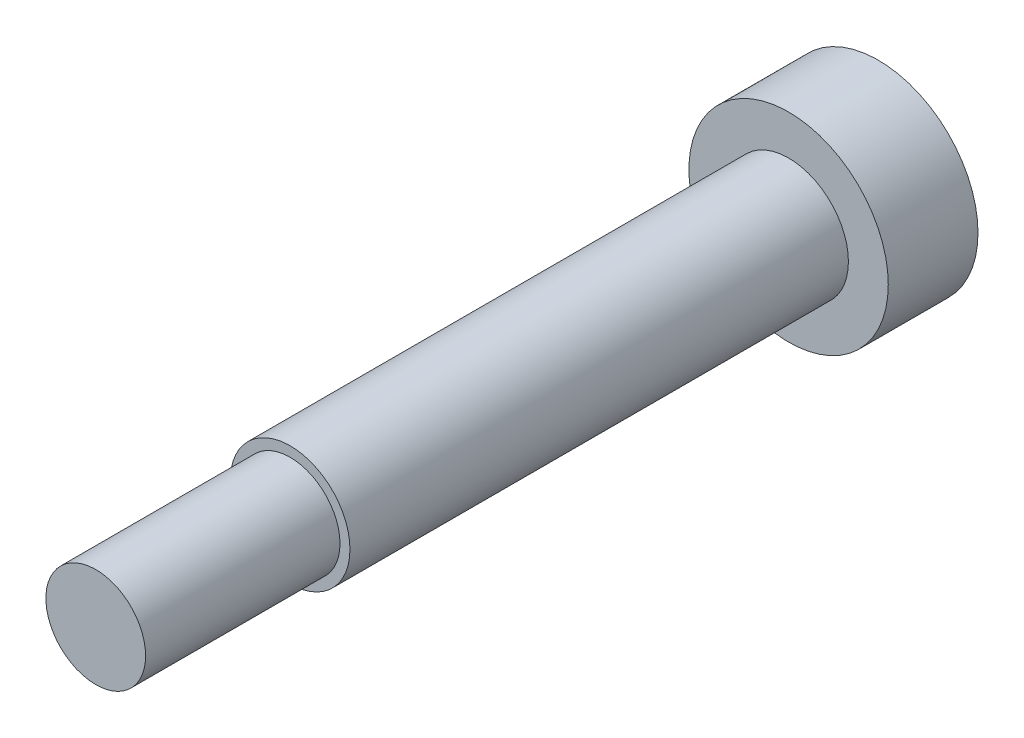
from build123d import *

# Parameters (mm, degrees)
SKETCH_1_R      = 5
EXTRUDE_1_DEPTH = 4.5
SKETCH_2_R      = 3
EXTRUDE_2_DEPTH = 25
SKETCH_3_R      = 2.5
EXTRUDE_3_DEPTH = 9.75


with BuildPart() as part:
    # 草图1 → 凸台-拉伸1 (new body)
    with BuildSketch(Plane.XY):
        Circle(SKETCH_1_R)
    extrude(amount=EXTRUDE_1_DEPTH)

    # 草图2 → 凸台-拉伸2 (add)
    with BuildSketch(Plane.XY.offset(4.5)):
        Circle(SKETCH_2_R)
    extrude(amount=EXTRUDE_2_DEPTH)

    # 草图3 → 凸台-拉伸3 (add)
    with BuildSketch(Plane.XY.offset(29.5)):
        Circle(SKETCH_3_R)
    extrude(amount=EXTRUDE_3_DEPTH)


solid = part.part
